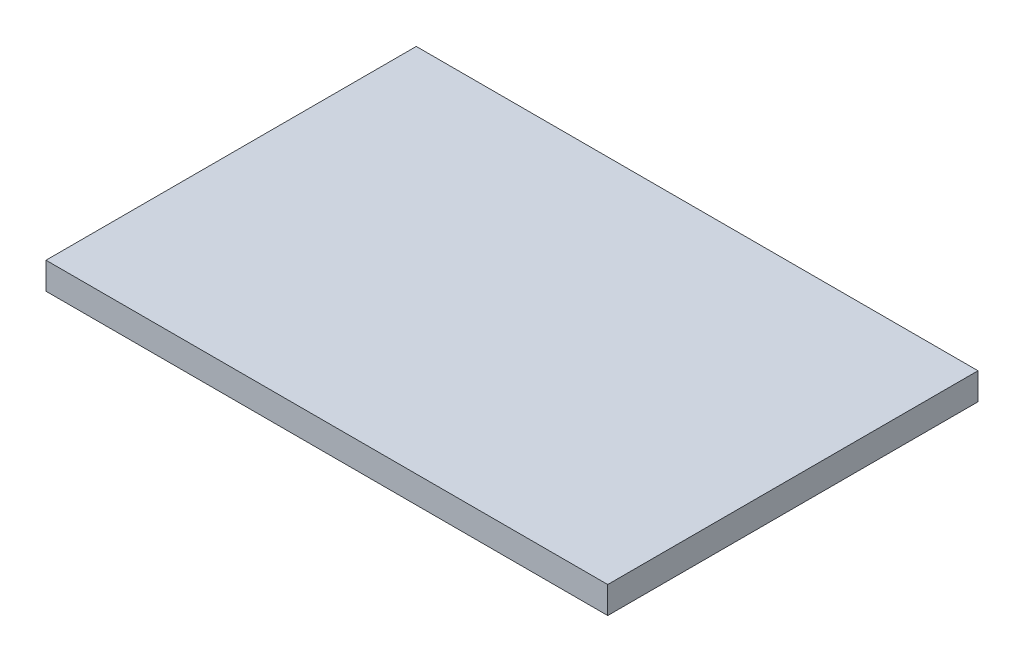
from build123d import *

# Parameters (mm, degrees)
SKETCH1_W           = 355
SKETCH1_H           = 234
BOSS_EXTRUDE1_DEPTH = 17


with BuildPart() as part:
    # Sketch1 → Boss-Extrude1 (new body)
    with BuildSketch(Plane(origin=(0, 0, 0), x_dir=(1, 0, 0), z_dir=(0, 1, 0))):
        with Locations((177.5, -117)):
            Rectangle(SKETCH1_W, SKETCH1_H)
    extrude(amount=BOSS_EXTRUDE1_DEPTH)


solid = part.part
